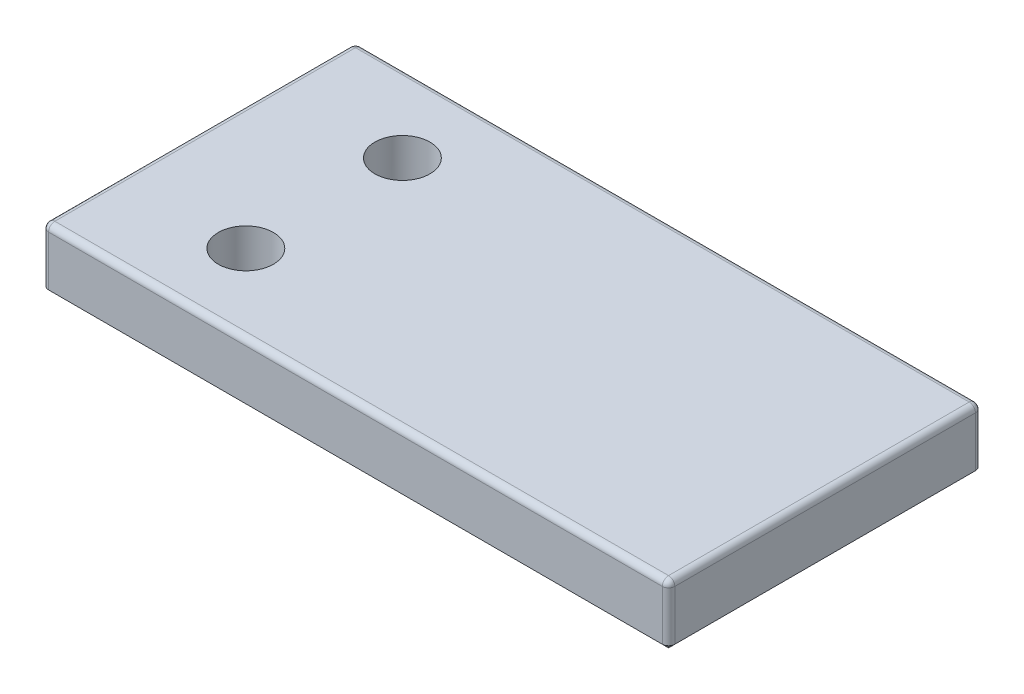
from build123d import *

# Parameters (mm, degrees)
SKETCH_1_W       = 100
SKETCH_1_H       = 50
EXTRUDE_1_DEPTH  = 10
M10X1_25_1_D     = 8.8
M10X1_25_1_DEPTH = 23.75
M10X1_25_1_TIP   = 2.643786724
FILLET_1_R       = 1
CHAMFER_1_SIZE   = 1
FILLET_2_R       = 1


with BuildPart() as part:
    # 草圖1 → 填料-伸長1 (new body)
    with BuildSketch(Plane(origin=(0, 0, 0), x_dir=(1, 0, 0), z_dir=(0, 1, 0))):
        with Locations((50, 25)):
            Rectangle(SKETCH_1_W, SKETCH_1_H)
    extrude(amount=EXTRUDE_1_DEPTH)

    # M10x1.25 螺紋孔1
    with Locations(Plane(origin=(20, 10, -37.5), x_dir=(0, 0, 1), z_dir=(0, 1, 0))):
        with Locations((0, 0), (25, 0)):
            Hole(M10X1_25_1_D / 2, depth=M10X1_25_1_DEPTH)
            with Locations((0, 0, -(M10X1_25_1_DEPTH + M10X1_25_1_TIP / 2))):  # 118° drill point
                Cone(0, M10X1_25_1_D / 2, M10X1_25_1_TIP, mode=Mode.SUBTRACT)

    # 圓角1
    fillet_1_edges = [part.edges().sort_by_distance(p)[0] for p in [
        (0, 5, -50),
        (100, 5, -50),
        (100, 5, 0),
        (0, 5, 0),
    ]]
    fillet(fillet_1_edges, radius=FILLET_1_R)

    # 導角1
    chamfer_1_edges = [part.edges().sort_by_distance(p)[0] for p in [
        (50, 0, -50),
        (0, 0, -25),
        (100, 0, -25),
        (50, 0, 0),
        (99.707106781, 0, -0.292893219),
        (0.292893219, 0, -0.292893219),
        (0.292893219, 0, -49.707106781),
        (99.707106781, 0, -49.707106781),
    ]]
    chamfer(chamfer_1_edges, length=CHAMFER_1_SIZE)

    # 圓角2
    fillet_2_edges = [part.edges().sort_by_distance(p)[0] for p in [
        (50, 10, -50),
        (100, 10, -25),
        (0, 10, -25),
        (50, 10, 0),
        (99.707106781, 10, -0.292893219),
        (0.292893219, 10, -0.292893219),
        (0.292893219, 10, -49.707106781),
        (99.707106781, 10, -49.707106781),
    ]]
    fillet(fillet_2_edges, radius=FILLET_2_R)


solid = part.part
